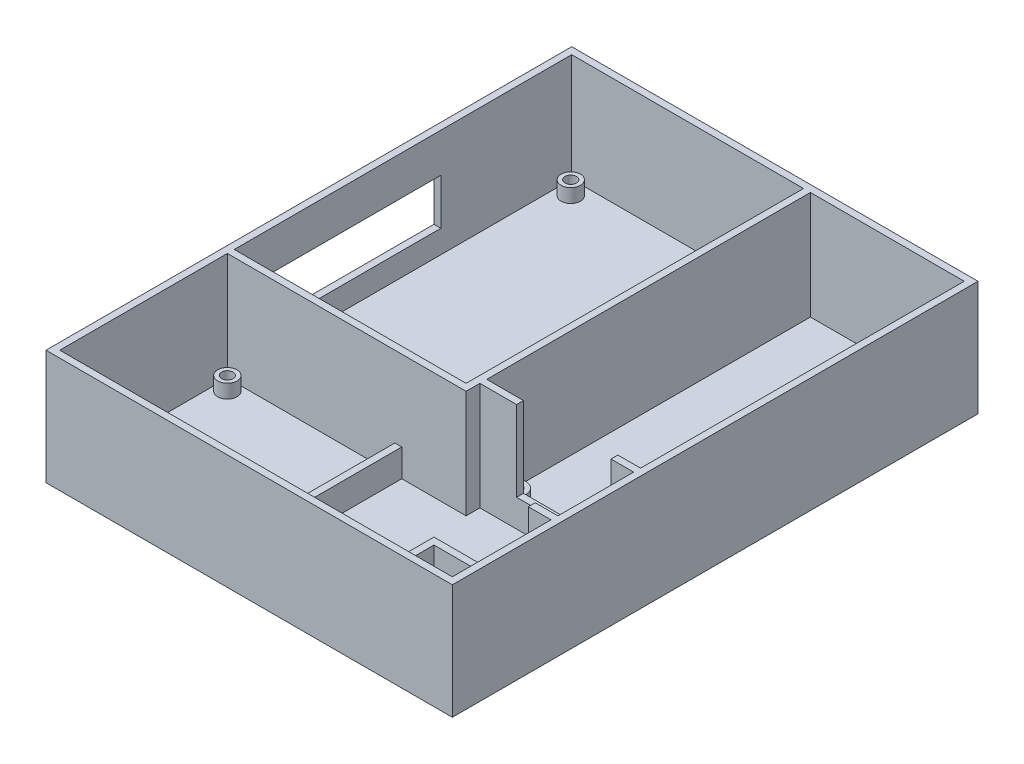
from build123d import *

# Parameters (mm, degrees)
SKETCH_3_W          = 88.5
SKETCH_3_H          = 114.5
SKETCH_3_W_2        = 36.5
SKETCH_3_H_2        = 36.5
SKETCH_3_W_3        = 50.5
SKETCH_3_H_3        = 73.5
SKETCH_3_W_4        = 33.5
SKETCH_3_H_4        = 70.5
SKETCH_3_W_5        = 25.5
SKETCH_3_H_5        = 21.5
EXTRUDE_1_DEPTH     = 25
SKETCH_3_3_W        = 36.5
SKETCH_3_3_H        = 36.5
SKETCH_3_3_R        = 2.1
SKETCH_3_3_W_2      = 50.5
SKETCH_3_3_H_2      = 73.5
SKETCH_3_3_W_3      = 33.5
SKETCH_3_3_H_3      = 70.5
SKETCH_3_3_R_2      = 2.5
SKETCH_3_3_W_4      = 25.5
SKETCH_3_3_H_4      = 21.5
EXTRUDE_2_DEPTH     = 1.5
SKETCH_3_5_R        = 2.1
SKETCH_3_5_R_2      = 1.25
SKETCH_3_5_R_3      = 2.5
SKETCH_3_5_R_4      = 1.5
EXTRUDE_4_DEPTH     = 4.5
CUT_EXTRUDE_1_DEPTH = 17.5
CUT_EXTRUDE_2_REACH = 148.859
SKETCH_5_W          = 40
SKETCH_5_H          = 10
SKETCH_5_W_2        = 11
SKETCH_5_H_2        = 5


with BuildPart() as part:
    # 草图3 → 凸台-拉伸1 (new body)
    with BuildSketch(Plane(origin=(0, 0, 0), x_dir=(1, 0, 0), z_dir=(0, 1, 0))):
        with Locations((44.25, 57.25)):
            Rectangle(SKETCH_3_W, SKETCH_3_H)
        Polygon((39.5, 1.5), (39.5, 38), (53.5, 38), (53.5, 41), (87, 41), (87, 24.5), (60, 24.5), (60, 1.5), align=None, mode=Mode.SUBTRACT)
        with Locations((19.75, 19.75)):
            Rectangle(SKETCH_3_W_2, SKETCH_3_H_2, mode=Mode.SUBTRACT)
        with Locations((26.75, 76.25)):
            Rectangle(SKETCH_3_W_3, SKETCH_3_H_3, mode=Mode.SUBTRACT)
        with Locations((70.25, 77.75)):
            Rectangle(SKETCH_3_W_4, SKETCH_3_H_4, mode=Mode.SUBTRACT)
        with Locations((74.25, 12.25)):
            Rectangle(SKETCH_3_W_5, SKETCH_3_H_5, mode=Mode.SUBTRACT)
    extrude(amount=EXTRUDE_1_DEPTH)

    # 草图3<3> → 凸台-拉伸2 (add)
    # profile 1 of 5: a face of its own
    with BuildSketch(Plane(origin=(0, 0, 0), x_dir=(1, 0, 0), z_dir=(0, 1, 0))):
        Polygon((39.5, 38), (39.5, 1.5), (60, 1.5), (60, 24.5), (87, 24.5), (87, 41), (53.5, 41), (53.5, 38), align=None)
    # profile 2 of 5: a face of its own
    with BuildSketch(Plane(origin=(0, 0, 0), x_dir=(1, 0, 0), z_dir=(0, 1, 0))):
        with Locations((19.75, 19.75)):
            Rectangle(SKETCH_3_3_W, SKETCH_3_3_H)
        with Locations(Location((4, 35.5, 0), (0, 0, 270))):
            Circle(SKETCH_3_3_R, mode=Mode.SUBTRACT)
    # profile 3 of 5: a face of its own
    with BuildSketch(Plane(origin=(0, 0, 0), x_dir=(1, 0, 0), z_dir=(0, 1, 0))):
        with Locations((26.75, 76.25)):
            Rectangle(SKETCH_3_3_W_2, SKETCH_3_3_H_2)
        with Locations(Location((4.5, 42.5, 0), (0, 0, 270))):
            Circle(SKETCH_3_3_R, mode=Mode.SUBTRACT)
        with Locations(Location((49, 42.5, 0), (0, 0, 270))):
            Circle(SKETCH_3_3_R, mode=Mode.SUBTRACT)
        with Locations(Location((4.5, 109.8, 0), (0, 0, 270))):
            Circle(SKETCH_3_3_R, mode=Mode.SUBTRACT)
        with Locations(Location((49, 109.8, 0), (0, 0, 270))):
            Circle(SKETCH_3_3_R, mode=Mode.SUBTRACT)
    # profile 4 of 5: a face of its own
    with BuildSketch(Plane(origin=(0, 0, 0), x_dir=(1, 0, 0), z_dir=(0, 1, 0))):
        with Locations((70.25, 77.75)):
            Rectangle(SKETCH_3_3_W_3, SKETCH_3_3_H_3)
        with Locations(Location((56.5, 45.5, 0), (0, 0, 270))):
            Circle(SKETCH_3_3_R_2, mode=Mode.SUBTRACT)
        with Locations(Location((84, 110, 0), (0, 0, 270))):
            Circle(SKETCH_3_3_R_2, mode=Mode.SUBTRACT)
    # profile 5 of 5: a face of its own
    with BuildSketch(Plane(origin=(0, 0, 0), x_dir=(1, 0, 0), z_dir=(0, 1, 0))):
        with Locations((74.25, 12.25)):
            Rectangle(SKETCH_3_3_W_4, SKETCH_3_3_H_4)
        with Locations(Location((65, 13.9, 0), (0, 0, 270))):
            Circle(SKETCH_3_3_R_2, mode=Mode.SUBTRACT)
    extrude(amount=EXTRUDE_2_DEPTH)

    # 草图3<5> → 凸台-拉伸4 (add)
    # profile 1 of 8: a face of its own
    with BuildSketch(Plane(origin=(0, 0, 0), x_dir=(1, 0, 0), z_dir=(0, 1, 0))):
        with Locations(Location((4, 35.5, 0), (0, 0, 270))):
            Circle(SKETCH_3_5_R)
        with Locations(Location((4, 35.5, 0), (0, 0, 270))):
            Circle(SKETCH_3_5_R_2, mode=Mode.SUBTRACT)
    # profile 2 of 8: a face of its own
    with BuildSketch(Plane(origin=(0, 0, 0), x_dir=(1, 0, 0), z_dir=(0, 1, 0))):
        with Locations(Location((4.5, 42.5, 0), (0, 0, 270))):
            Circle(SKETCH_3_5_R)
        with Locations(Location((4.5, 42.5, 0), (0, 0, 270))):
            Circle(SKETCH_3_5_R_2, mode=Mode.SUBTRACT)
    # profile 3 of 8: a face of its own
    with BuildSketch(Plane(origin=(0, 0, 0), x_dir=(1, 0, 0), z_dir=(0, 1, 0))):
        with Locations(Location((49, 42.5, 0), (0, 0, 270))):
            Circle(SKETCH_3_5_R)
        with Locations(Location((49, 42.5, 0), (0, 0, 270))):
            Circle(SKETCH_3_5_R_2, mode=Mode.SUBTRACT)
    # profile 4 of 8: a face of its own
    with BuildSketch(Plane(origin=(0, 0, 0), x_dir=(1, 0, 0), z_dir=(0, 1, 0))):
        with Locations(Location((4.5, 109.8, 0), (0, 0, 270))):
            Circle(SKETCH_3_5_R)
        with Locations(Location((4.5, 109.8, 0), (0, 0, 270))):
            Circle(SKETCH_3_5_R_2, mode=Mode.SUBTRACT)
    # profile 5 of 8: a face of its own
    with BuildSketch(Plane(origin=(0, 0, 0), x_dir=(1, 0, 0), z_dir=(0, 1, 0))):
        with Locations(Location((49, 109.8, 0), (0, 0, 270))):
            Circle(SKETCH_3_5_R)
        with Locations(Location((49, 109.8, 0), (0, 0, 270))):
            Circle(SKETCH_3_5_R_2, mode=Mode.SUBTRACT)
    # profile 6 of 8: a face of its own
    with BuildSketch(Plane(origin=(0, 0, 0), x_dir=(1, 0, 0), z_dir=(0, 1, 0))):
        with Locations(Location((84, 110, 0), (0, 0, 270))):
            Circle(SKETCH_3_5_R_3)
        with Locations(Location((84, 110, 0), (0, 0, 270))):
            Circle(SKETCH_3_5_R_4, mode=Mode.SUBTRACT)
    # profile 7 of 8: a face of its own
    with BuildSketch(Plane(origin=(0, 0, 0), x_dir=(1, 0, 0), z_dir=(0, 1, 0))):
        with Locations(Location((56.5, 45.5, 0), (0, 0, 270))):
            Circle(SKETCH_3_5_R_3)
        with Locations(Location((56.5, 45.5, 0), (0, 0, 270))):
            Circle(SKETCH_3_5_R_4, mode=Mode.SUBTRACT)
    # profile 8 of 8: a face of its own
    with BuildSketch(Plane(origin=(0, 0, 0), x_dir=(1, 0, 0), z_dir=(0, 1, 0))):
        with Locations(Location((65, 13.9, 0), (0, 0, 270))):
            Circle(SKETCH_3_5_R_3)
        with Locations(Location((65, 13.9, 0), (0, 0, 270))):
            Circle(SKETCH_3_5_R_2, mode=Mode.SUBTRACT)
    extrude(amount=EXTRUDE_4_DEPTH)

    # 草图4 → 切除-拉伸1 (cut)
    with BuildSketch(Plane(origin=(0, 25, 0), x_dir=(1, 0, 0), z_dir=(0, 1, 0))):
        Polygon((61.5, 1.5), (38, 1.5), (38, 38), (61.5, 38), (61.5, 44.990704611), (82.058079057, 44.990704611), (82.058079057, 21.502306723), (61.5, 21.502306723), align=None)
    extrude(amount=-CUT_EXTRUDE_1_DEPTH, mode=Mode.SUBTRACT)

    # 草图5 → 切除-拉伸2 (cut, up to next)
    with BuildSketch(Plane.ZY, mode=Mode.PRIVATE) as cut_extrude_2_sk1:
        with Locations((-64.5, 11.5)):
            Rectangle(SKETCH_5_W, SKETCH_5_H)
    cut_extrude_2_tool1 = extrude(cut_extrude_2_sk1.sketch, amount=-CUT_EXTRUDE_2_REACH, mode=Mode.PRIVATE) & part.part
    # 草图5 → 切除-拉伸2 (cut, up to next)
    with BuildSketch(Plane.ZY, mode=Mode.PRIVATE) as cut_extrude_2_sk2:
        with Locations((-9, 9)):
            Rectangle(SKETCH_5_W_2, SKETCH_5_H_2)
    cut_extrude_2_tool2 = extrude(cut_extrude_2_sk2.sketch, amount=-CUT_EXTRUDE_2_REACH, mode=Mode.PRIVATE) & part.part
    add(cut_extrude_2_tool1.solids().sort_by_distance((0, 11.5, -64.5))[0], mode=Mode.SUBTRACT)
    add(cut_extrude_2_tool2.solids().sort_by_distance((0, 9, -9))[0], mode=Mode.SUBTRACT)


solid = part.part
